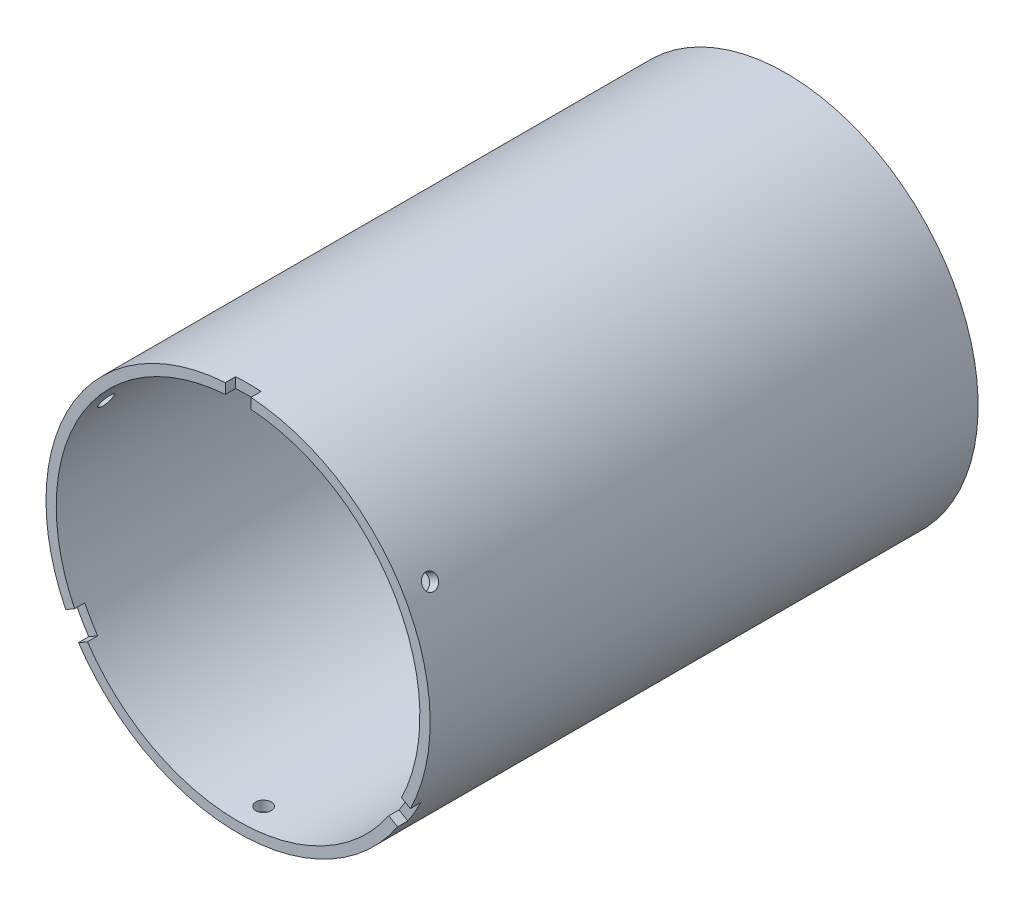
from build123d import *

# Parameters (mm, degrees)
SKETCH_1_R               = 37.5
SKETCH_1_R_2             = 35.5
EXTRUDE_1_DEPTH          = 214
SKETCH_2_R               = 1.5
CUT_EXTRUDE_1_DEPTH      = 88
PATTERN_CIRCULAR_1_COUNT = 3
SKETCH_3_W               = 5
SKETCH_3_H               = 20.375275098
CUT_EXTRUDE_2_DEPTH      = 2
PATTERN_CIRCULAR_2_COUNT = 3
SKETCH_4_W               = 5
SKETCH_4_H               = 20.375275098
CUT_EXTRUDE_3_DEPTH      = 2
PATTERN_CIRCULAR_3_COUNT = 3
CUT_EXTRUDE_4_DEPTH      = 156
CUT_EXTRUDE_4_DEPTH_BACK = 165
SKETCH_5_W               = 164.762813688
SKETCH_5_H               = 214


with BuildPart() as part:
    # Эскиз1 → Бобышка-Вытянуть1 (new body)
    with BuildSketch(Plane.XY):
        Circle(SKETCH_1_R)
        Circle(SKETCH_1_R_2, mode=Mode.SUBTRACT)
    extrude(amount=EXTRUDE_1_DEPTH)

    # Эскиз2 → Вырез-Вытянуть1 (cut)
    with BuildSketch(Plane(origin=(0, 0, 0), x_dir=(1, 0, 0), z_dir=(0, 1, 0))):
        with Locations(Location((0, -5, 0), (0, 0, 270))):
            Circle(SKETCH_2_R)
        with Locations(Location((0, -209, 0), (0, 0, 270))):
            Circle(SKETCH_2_R)
    cut_extrude_1 = extrude(amount=-CUT_EXTRUDE_1_DEPTH, mode=Mode.SUBTRACT)

    # Круговой массив1: Вырез-Вытянуть1 ×3 about axis
    pattern_circular_1_axis = Axis((0, 0, 214), (0, 0, -1))
    for i in range(1, PATTERN_CIRCULAR_1_COUNT):
        add(cut_extrude_1.rotate(pattern_circular_1_axis, i * 360 / PATTERN_CIRCULAR_1_COUNT), mode=Mode.SUBTRACT)

    # Эскиз3 → Вырез-Вытянуть2 (cut)
    with BuildSketch(Plane(origin=(0, 0, 0), x_dir=(-1, 0, 0), z_dir=(0, 0, -1))):
        with Locations((0, 27.321603857)):
            Rectangle(SKETCH_3_W, SKETCH_3_H)
    cut_extrude_2 = extrude(amount=-CUT_EXTRUDE_2_DEPTH, mode=Mode.SUBTRACT)

    # Круговой массив2: Вырез-Вытянуть2 ×3 about axis
    pattern_circular_2_axis = Axis((0, 0, 0), (0, 0, 1))
    for i in range(1, PATTERN_CIRCULAR_2_COUNT):
        add(cut_extrude_2.rotate(pattern_circular_2_axis, i * 360 / PATTERN_CIRCULAR_2_COUNT), mode=Mode.SUBTRACT)

    # Эскиз4 → Вырез-Вытянуть3 (cut)
    with BuildSketch(Plane.XY.offset(214)):
        with Locations((0, 27.321603857)):
            Rectangle(SKETCH_4_W, SKETCH_4_H)
    cut_extrude_3 = extrude(amount=-CUT_EXTRUDE_3_DEPTH, mode=Mode.SUBTRACT)

    # Круговой массив3: Вырез-Вытянуть3 ×3 about axis
    pattern_circular_3_axis = Axis((0, 0, 0), (0, 0, 1))
    for i in range(1, PATTERN_CIRCULAR_3_COUNT):
        add(cut_extrude_3.rotate(pattern_circular_3_axis, i * 360 / PATTERN_CIRCULAR_3_COUNT), mode=Mode.SUBTRACT)

    # Эскиз5 → Вырез-Вытянуть4 (cut, two sides: drawn at the far end of the back side and taken through both)
    with BuildSketch(Plane(origin=(0, 0, 0), x_dir=(1, 0, 0), z_dir=(0, 1, 0)).offset(-CUT_EXTRUDE_4_DEPTH_BACK)):
        Rectangle(SKETCH_5_W, SKETCH_5_H)
    extrude(amount=CUT_EXTRUDE_4_DEPTH + CUT_EXTRUDE_4_DEPTH_BACK, mode=Mode.SUBTRACT)


solid = part.part
